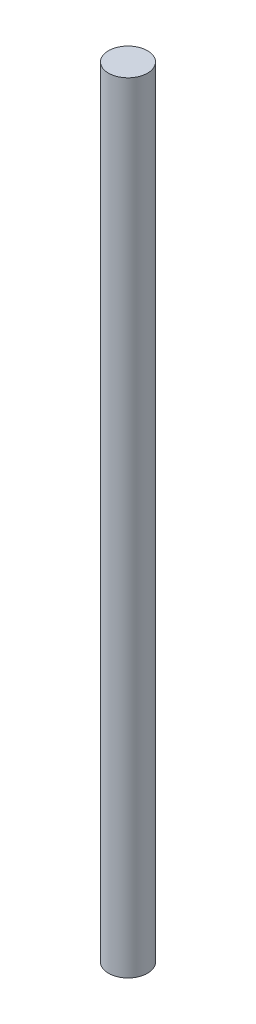
from build123d import *

# Parameters (mm, degrees)
SKETCH1_R           = 0.8
BOSS_EXTRUDE1_DEPTH = 32


with BuildPart() as part:
    # Sketch1 → Boss-Extrude1 (new body)
    with BuildSketch(Plane(origin=(0, 0, 0), x_dir=(1, 0, 0), z_dir=(0, 1, 0))):
        with Locations(Location((0, 0, 0), (0, 0, 270))):
            Circle(SKETCH1_R)
    extrude(amount=BOSS_EXTRUDE1_DEPTH)


solid = part.part
